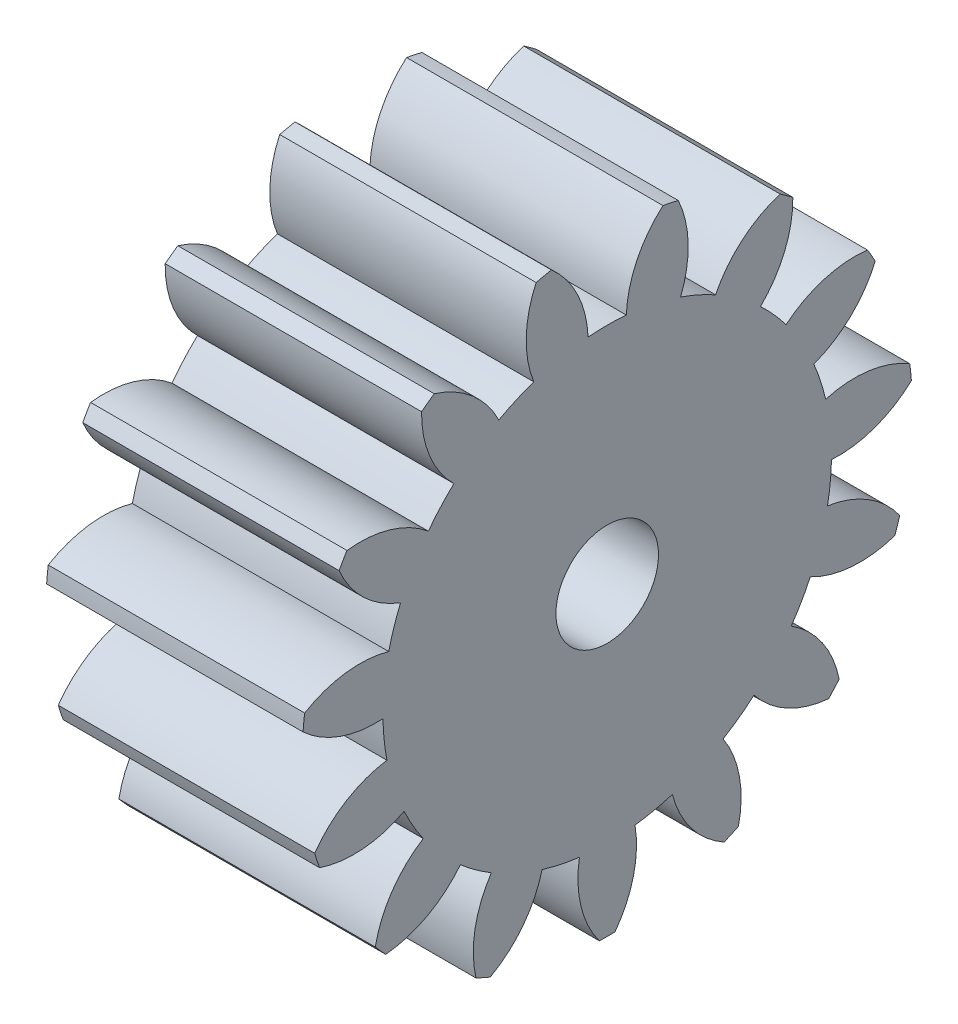
from build123d import *

# Parameters (mm, degrees)
BASPROSKE_W     = 5
BASPROSKE_H     = 5.95
TOOTHCUT_DEPTH  = 10.788002861
TEETHCUTS_COUNT = 15
TEETHCUTS_ANGLE = 336
BORSKE_R        = 1
BORE_DEPTH      = 50.0000508


with BuildPart() as part:
    # BasProSke → Base-Revolve (revolve)
    with BuildSketch(Plane(origin=(0, 0, 0), x_dir=(1, 0, 0), z_dir=(0, 1, 0)), mode=Mode.PRIVATE) as base_revolve_sk:
        with Locations((2.5, 2.975)):
            Rectangle(BASPROSKE_W, BASPROSKE_H)
    revolve(base_revolve_sk.sketch.rotate(Axis((-10, 0, 0), (1, 0, 0)), 180), axis=Axis((-10, 0, 0), (1, 0, 0)))

    # TooCutSke → ToothCut (cut, through all)
    with BuildSketch(Plane(origin=(0, 0, 0), x_dir=(0, 0, -1), z_dir=(1, 0, 0))):
        with BuildLine():
            ThreePointArc((0.372674482, 4.358094736), (0, 4.374), (-0.372674482, 4.358094736))
            ThreePointArc((-0.372674482, 4.358094736), (-0.583982763, 5.191902292), (-1.111855836, 5.871046053))
            ThreePointArc((-1.111855836, 5.871046053), (0, 5.9754), (1.111855836, 5.871046053))
            ThreePointArc((1.111855836, 5.871046053), (0.583982763, 5.191902292), (0.372674482, 4.358094736))
        make_face()
    toothcut = extrude(amount=TOOTHCUT_DEPTH, mode=Mode.SUBTRACT)

    # TeethCuts: ToothCut ×15 about axis
    teethcuts_axis = Axis((-10, 0, 0), (1, 0, 0))
    for i in range(1, TEETHCUTS_COUNT):
        add(toothcut.rotate(teethcuts_axis, i * TEETHCUTS_ANGLE / (TEETHCUTS_COUNT - 1)), mode=Mode.SUBTRACT)

    # BorSke → Bore (cut, symmetric)
    with BuildSketch(Plane(origin=(0, 0, 0), x_dir=(0, 0, -1), z_dir=(1, 0, 0))):
        with Locations(Location((0, 0, 0), (0, 0, 180))):
            Circle(BORSKE_R)
    extrude(amount=BORE_DEPTH, both=True, mode=Mode.SUBTRACT)


solid = part.part
